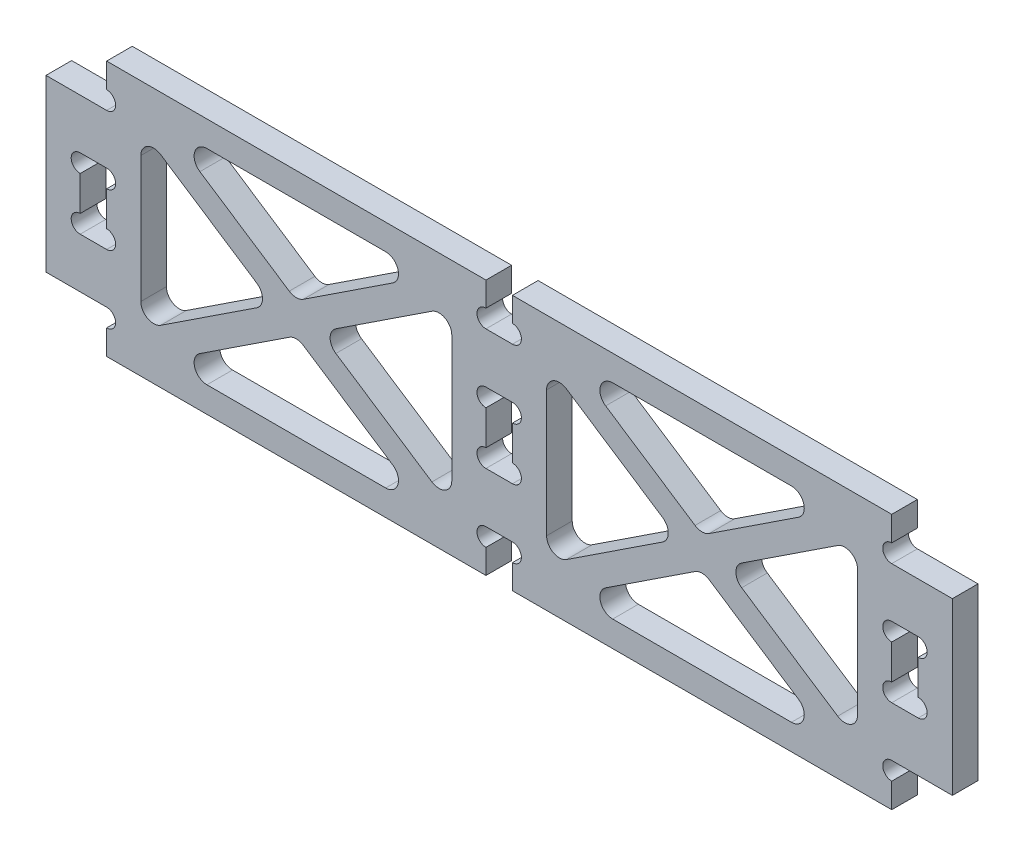
from build123d import *

# Parameters (mm, degrees)
EXTRUDE_1_DEPTH = 3
FILLET_1_R      = 1.5


with BuildPart() as part:
    # 草图1 → 凸台-拉伸1 (new body)
    with BuildSketch(Plane.XY):
        with BuildLine():
            Line((100.55, -9.975), (100.55, 9.975))
            Line((100.55, 9.975), (93.45, 9.975))
            ThreePointArc((93.45, 9.975), (92.4, 11.025), (93.45, 12.075))
            Line((93.45, 12.075), (93.45, 14.975))
            Line((93.45, 14.975), (49.05, 14.975))
            Line((49.05, 14.975), (49.05, 12.125))
            ThreePointArc((49.05, 12.125), (49.79246212, 11.81746212), (50.1, 11.075))
            ThreePointArc((50.1, 11.075), (49.79246212, 10.33253788), (49.05, 10.025))
            Line((49.05, 10.025), (45.95, 10.025))
            ThreePointArc((45.95, 10.025), (44.9, 11.075), (45.95, 12.125))
            Line((45.95, 12.125), (45.95, 14.975))
            Line((45.95, 14.975), (1.55, 14.975))
            Line((1.55, 14.975), (1.55, 12.075))
            ThreePointArc((1.55, 12.075), (2.29246212, 11.76746212), (2.6, 11.025))
            ThreePointArc((2.6, 11.025), (2.29246212, 10.28253788), (1.55, 9.975))
            Line((1.55, 9.975), (-5.55, 9.975))
            Line((-5.55, 9.975), (-5.55, -9.975))
            Line((-5.55, -9.975), (1.55, -9.975))
            ThreePointArc((1.55, -9.975), (2.29246212, -10.28253788), (2.6, -11.025))
            ThreePointArc((2.6, -11.025), (2.29246212, -11.76746212), (1.55, -12.075))
            Line((1.55, -12.075), (1.55, -14.975))
            Line((1.55, -14.975), (45.95, -14.975))
            Line((45.95, -14.975), (45.95, -12.125))
            ThreePointArc((45.95, -12.125), (44.9, -11.075), (45.95, -10.025))
            Line((45.95, -10.025), (49.05, -10.025))
            ThreePointArc((49.05, -10.025), (49.79246212, -10.33253788), (50.1, -11.075))
            ThreePointArc((50.1, -11.075), (49.79246212, -11.81746212), (49.05, -12.125))
            Line((49.05, -12.125), (49.05, -14.975))
            Line((49.05, -14.975), (93.45, -14.975))
            Line((93.45, -14.975), (93.45, -12.075))
            ThreePointArc((93.45, -12.075), (92.4, -11.025), (93.45, -9.975))
            Line((93.45, -9.975), (100.55, -9.975))
        make_face()
        with BuildLine():
            ThreePointArc((2.6, -3.075), (2.29246212, -3.81746212), (1.55, -4.125))
            Line((1.55, -4.125), (-1.55, -4.125))
            ThreePointArc((-1.55, -4.125), (-2.6, -3.075), (-1.55, -2.025))
            Line((-1.55, -2.025), (-1.55, 2.025))
            ThreePointArc((-1.55, 2.025), (-2.6, 3.075), (-1.55, 4.125))
            Line((-1.55, 4.125), (1.55, 4.125))
            ThreePointArc((1.55, 4.125), (2.29246212, 3.81746212), (2.6, 3.075))
            ThreePointArc((2.6, 3.075), (2.29246212, 2.33253788), (1.55, 2.025))
            Line((1.55, 2.025), (1.55, -2.025))
            ThreePointArc((1.55, -2.025), (2.29246212, -2.33253788), (2.6, -3.075))
        make_face(mode=Mode.SUBTRACT)
        Polygon((39.221033587, -11.975), (8.278966413, -11.975), (23.75, -1.795569934), align=None, mode=Mode.SUBTRACT)
        Polygon((26.478966413, 0), (41.95, 10.179430066), (41.95, -10.179430066), align=None, mode=Mode.SUBTRACT)
        with BuildLine():
            ThreePointArc((50.1, -3.075), (49.79246212, -3.81746212), (49.05, -4.125))
            Line((49.05, -4.125), (45.95, -4.125))
            ThreePointArc((45.95, -4.125), (44.9, -3.075), (45.95, -2.025))
            Line((45.95, -2.025), (45.95, 2.025))
            ThreePointArc((45.95, 2.025), (44.9, 3.075), (45.95, 4.125))
            Line((45.95, 4.125), (49.05, 4.125))
            ThreePointArc((49.05, 4.125), (49.79246212, 3.81746212), (50.1, 3.075))
            ThreePointArc((50.1, 3.075), (49.79246212, 2.33253788), (49.05, 2.025))
            Line((49.05, 2.025), (49.05, -2.025))
            ThreePointArc((49.05, -2.025), (49.79246212, -2.33253788), (50.1, -3.075))
        make_face(mode=Mode.SUBTRACT)
        Polygon((55.778966413, -11.975), (71.25, -1.795569934), (86.721033587, -11.975), align=None, mode=Mode.SUBTRACT)
        Polygon((53.05, 10.179430066), (68.521033587, 0), (53.05, -10.179430066), align=None, mode=Mode.SUBTRACT)
        with BuildLine():
            ThreePointArc((97.6, -3.075), (97.29246212, -3.81746212), (96.55, -4.125))
            Line((96.55, -4.125), (93.45, -4.125))
            ThreePointArc((93.45, -4.125), (92.4, -3.075), (93.45, -2.025))
            Line((93.45, -2.025), (93.45, 2.025))
            ThreePointArc((93.45, 2.025), (92.4, 3.075), (93.45, 4.125))
            Line((93.45, 4.125), (96.55, 4.125))
            ThreePointArc((96.55, 4.125), (97.29246212, 3.81746212), (97.6, 3.075))
            ThreePointArc((97.6, 3.075), (97.29246212, 2.33253788), (96.55, 2.025))
            Line((96.55, 2.025), (96.55, -2.025))
            ThreePointArc((96.55, -2.025), (97.29246212, -2.33253788), (97.6, -3.075))
        make_face(mode=Mode.SUBTRACT)
        Polygon((21.021033587, 0), (5.55, -10.179430066), (5.55, 10.179430066), align=None, mode=Mode.SUBTRACT)
        Polygon((23.75, 1.795569934), (8.278966413, 11.975), (39.221033587, 11.975), align=None, mode=Mode.SUBTRACT)
        Polygon((55.778966413, 11.975), (86.721033587, 11.975), (71.25, 1.795569934), align=None, mode=Mode.SUBTRACT)
        Polygon((89.45, 10.179430066), (89.45, -10.179430066), (73.978966413, 0), align=None, mode=Mode.SUBTRACT)
    extrude(amount=EXTRUDE_1_DEPTH)

    # 圆角1
    fillet_1_edges = [part.edges().sort_by_distance(p)[0] for p in [
        (55.778966413, 11.975, 1.5),
        (71.25, 1.795569934, 1.5),
        (86.721033587, 11.975, 1.5),
        (8.278966413, -11.975, 1.5),
        (39.221033587, -11.975, 1.5),
        (23.75, -1.795569934, 1.5),
        (41.95, -10.179430066, 1.5),
        (41.95, 10.179430066, 1.5),
        (26.478966413, 0, 1.5),
        (21.021033587, 0, 1.5),
        (5.55, 10.179430066, 1.5),
        (5.55, -10.179430066, 1.5),
        (39.221033587, 11.975, 1.5),
        (8.278966413, 11.975, 1.5),
        (23.75, 1.795569934, 1.5),
        (53.05, -10.179430066, 1.5),
        (68.521033587, 0, 1.5),
        (53.05, 10.179430066, 1.5),
        (86.721033587, -11.975, 1.5),
        (71.25, -1.795569934, 1.5),
        (55.778966413, -11.975, 1.5),
        (73.978966413, 0, 1.5),
        (89.45, -10.179430066, 1.5),
        (89.45, 10.179430066, 1.5),
    ]]
    fillet(fillet_1_edges, radius=FILLET_1_R)


solid = part.part
